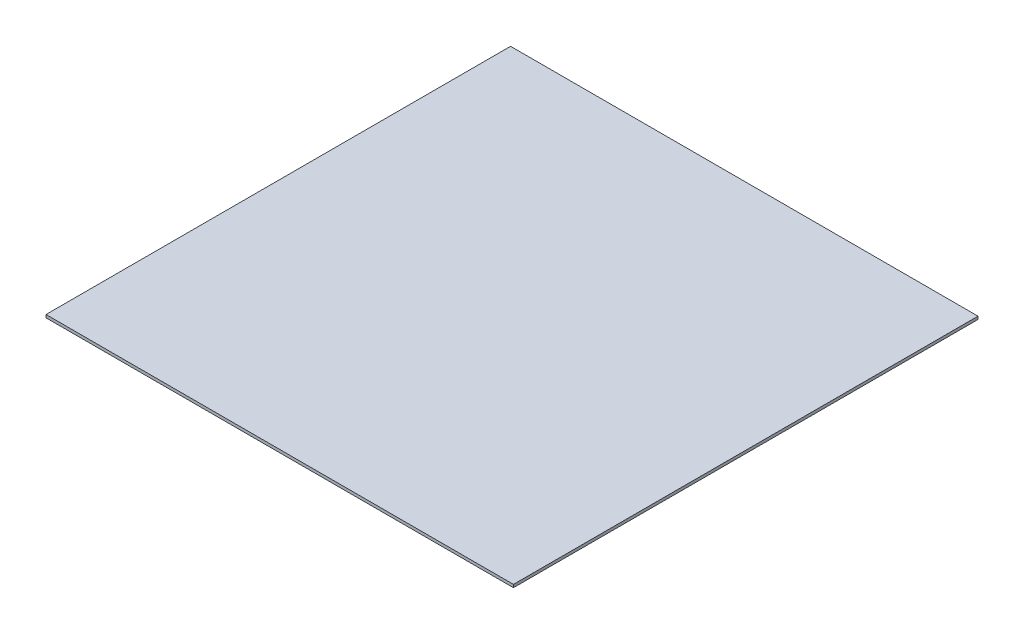
from build123d import *

# Parameters (mm, degrees)
SKETCH1_W           = 514.35
SKETCH1_H           = 511.175
BOSS_EXTRUDE1_DEPTH = 1.5875


with BuildPart() as part:
    # Sketch1 → Boss-Extrude1 (new, symmetric)
    with BuildSketch(Plane(origin=(0, 0, 0), x_dir=(1, 0, 0), z_dir=(0, 1, 0))):
        Rectangle(SKETCH1_W, SKETCH1_H)
    extrude(amount=BOSS_EXTRUDE1_DEPTH, both=True)


solid = part.part
